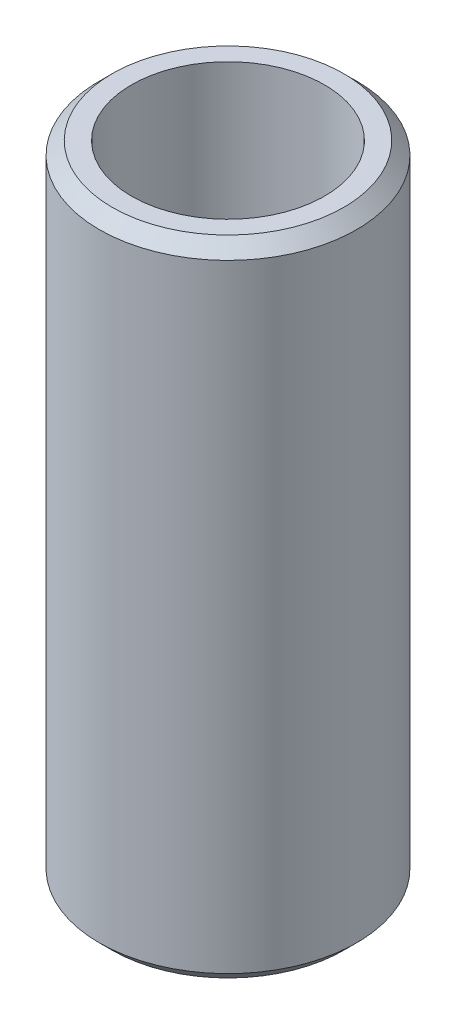
from build123d import *

# Parameters (mm, degrees)
SKETCH1_R           = 4
SKETCH1_R_2         = 3
BOSS_EXTRUDE1_DEPTH = 20
CHAMFER1_SIZE       = 0.4


with BuildPart() as part:
    # Sketch1 → Boss-Extrude1 (new body)
    with BuildSketch(Plane(origin=(0, 0, 0), x_dir=(1, 0, 0), z_dir=(0, 1, 0))):
        Circle(SKETCH1_R)
        Circle(SKETCH1_R_2, mode=Mode.SUBTRACT)
    extrude(amount=BOSS_EXTRUDE1_DEPTH)

    # Chamfer1
    chamfer1_edges = [part.edges().sort_by_distance(p)[0] for p in [
        (-4, 0, 0),
        (-4, 20, 0),
    ]]
    chamfer(chamfer1_edges, length=CHAMFER1_SIZE)


solid = part.part
